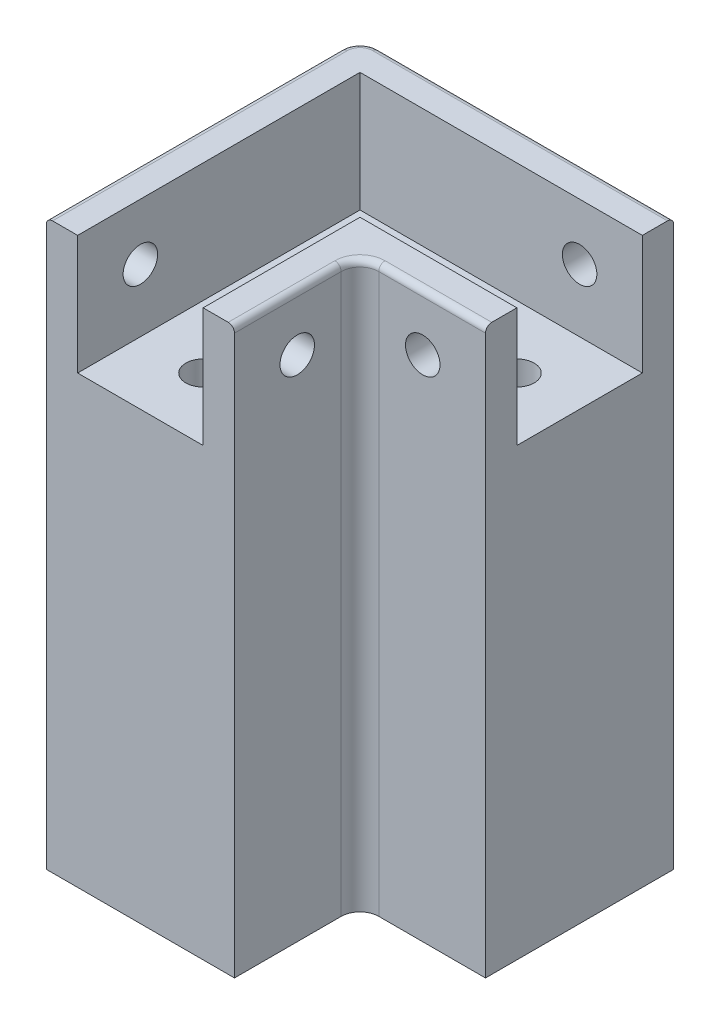
from build123d import *

# Parameters (mm, degrees)
SKETCH1_W           = 50
SKETCH1_H           = 50
BOSS_EXTRUDE1_DEPTH = 90
CUT_EXTRUDE1_DEPTH  = 19
SKETCH3_W           = 20.00325309
SKETCH3_H           = 20
CUT_EXTRUDE2_DEPTH  = 115.455231423
SKETCH4_R           = 6
CUT_EXTRUDE3_DEPTH  = 66
SKETCH6_R           = 2.75
CUT_EXTRUDE4_DEPTH  = 97.726418315
SKETCH7_R           = 2.75
CUT_EXTRUDE5_DEPTH  = 115.455231423
SKETCH8_R           = 2.75
CUT_EXTRUDE6_DEPTH  = 115.455231423
FILLET1_R           = 3
FILLET2_R           = 1


with BuildPart() as part:
    # Sketch1 → Boss-Extrude1 (new body)
    with BuildSketch(Plane(origin=(0, 0, 0), x_dir=(1, 0, 0), z_dir=(0, 1, 0))):
        with Locations((25, 25)):
            Rectangle(SKETCH1_W, SKETCH1_H)
    extrude(amount=BOSS_EXTRUDE1_DEPTH)

    # Sketch2 → Cut-Extrude1 (cut)
    with BuildSketch(Plane(origin=(0, 90, 0), x_dir=(1, 0, 0), z_dir=(0, 1, 0))):
        Polygon((5, 0), (25, 0), (25, 25), (50, 25), (50, 45), (5, 45), align=None)
    extrude(amount=-CUT_EXTRUDE1_DEPTH, mode=Mode.SUBTRACT)

    # Sketch3 → Cut-Extrude2 (cut, through all)
    with BuildSketch(Plane(origin=(0, 90, 0), x_dir=(1, 0, 0), z_dir=(0, 1, 0))):
        with Locations((39.998373455, 10)):
            Rectangle(SKETCH3_W, SKETCH3_H)
    extrude(amount=-CUT_EXTRUDE2_DEPTH, mode=Mode.SUBTRACT)

    # Sketch4 → Cut-Extrude3 (cut)
    with BuildSketch(Plane.XZ):
        with Locations(Location((14.998373455, -10, 0), (0, 0, 270))):
            Circle(SKETCH4_R)
        with Locations(Location((40, -35, 0), (0, 0, 270))):
            Circle(SKETCH4_R)
        with Locations(Location((14.998373455, -35, 0), (0, 0, 270))):
            Circle(SKETCH4_R)
    extrude(amount=-CUT_EXTRUDE3_DEPTH, mode=Mode.SUBTRACT)

    # Sketch6 → Cut-Extrude4 (cut, through all)
    with BuildSketch(Plane.XZ.offset(-66)):
        with Locations(Location((14.998373455, -10, 0), (0, 0, 270))):
            Circle(SKETCH6_R)
        with Locations(Location((40, -35, 0), (0, 0, 270))):
            Circle(SKETCH6_R)
        with Locations(Location((14.998373455, -35, 0), (0, 0, 270))):
            Circle(SKETCH6_R)
    extrude(amount=-CUT_EXTRUDE4_DEPTH, mode=Mode.SUBTRACT)

    # Sketch7 → Cut-Extrude5 (cut, through all)
    with BuildSketch(Plane.ZY):
        with Locations((-10, 81)):
            Circle(SKETCH7_R)
    extrude(amount=-CUT_EXTRUDE5_DEPTH, mode=Mode.SUBTRACT)

    # Sketch8 → Cut-Extrude6 (cut, through all)
    with BuildSketch(Plane(origin=(0, 0, -50), x_dir=(-1, 0, 0), z_dir=(0, 0, -1))):
        with Locations((-40, 81)):
            Circle(SKETCH8_R)
    extrude(amount=-CUT_EXTRUDE6_DEPTH, mode=Mode.SUBTRACT)

    # Fillet1
    fillet1_edges = [part.edges().sort_by_distance(p)[0] for p in [
        (29.99674691, 45, -20),
        (0, 45, -50),
    ]]
    fillet(fillet1_edges, radius=FILLET1_R)

    # Fillet2
    fillet2_edges = [part.edges().sort_by_distance(p)[0] for p in [
        (30.875426566, 90, -19.121320344),
        (26.5, 90, -50),
        (41.498373455, 90, -20),
        (29.99674691, 90, -8.5),
        (0, 90, -23.5),
        (0.878679656, 90, -49.121320344),
    ]]
    fillet(fillet2_edges, radius=FILLET2_R)


solid = part.part
